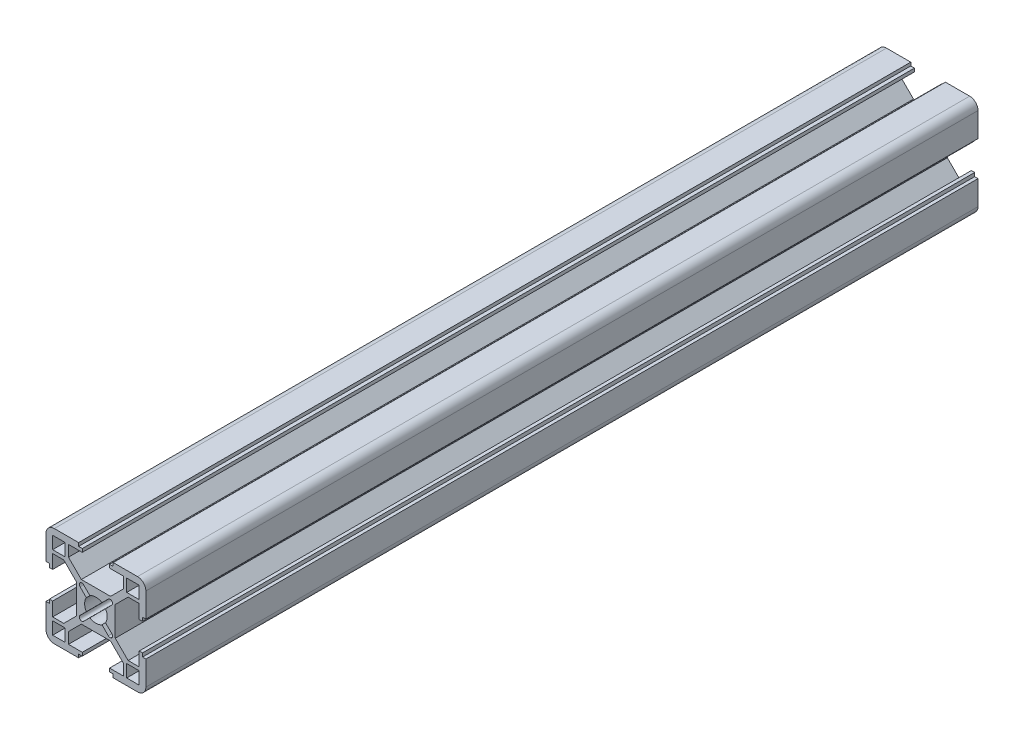
from build123d import *

# Parameters (mm, degrees)
SKETCH_1_W      = 3.75
SKETCH_1_H      = 3.75
EXTRUDE_1_DEPTH = 250


with BuildPart() as part:
    # 草图1 → 凸台-拉伸1 (new body)
    with BuildSketch(Plane.XY):
        with BuildLine():
            Line((-5.2, -15), (-5.2, -14))
            Line((-5.2, -14), (-4.1, -14))
            Line((-4.1, -14), (-4.1, -13))
            Line((-4.1, -13), (-8.25, -13))
            Line((-8.25, -13), (-8.25, -9.664213562))
            Line((-8.25, -9.664213562), (-4.385786438, -5.8))
            Line((-4.385786438, -5.8), (4.385786438, -5.8))
            Line((4.385786438, -5.8), (8.25, -9.664213562))
            Line((8.25, -9.664213562), (8.25, -13))
            Line((8.25, -13), (4.1, -13))
            Line((4.1, -13), (4.1, -14))
            Line((4.1, -14), (5.2, -14))
            Line((5.2, -14), (5.2, -15))
            Line((5.2, -15), (12.5, -15))
            ThreePointArc((12.5, -15), (14.267766953, -14.267766953), (15, -12.5))
            Line((15, -12.5), (15, -5.2))
            Line((15, -5.2), (14, -5.2))
            Line((14, -5.2), (14, -4.1))
            Line((14, -4.1), (13, -4.1))
            Line((13, -4.1), (13, -8.25))
            Line((13, -8.25), (9.664213562, -8.25))
            Line((9.664213562, -8.25), (5.8, -4.385786438))
            Line((5.8, -4.385786438), (5.8, 4.385786438))
            Line((5.8, 4.385786438), (9.664213562, 8.25))
            Line((9.664213562, 8.25), (13, 8.25))
            Line((13, 8.25), (13, 4.1))
            Line((13, 4.1), (14, 4.1))
            Line((14, 4.1), (14, 5.2))
            Line((14, 5.2), (15, 5.2))
            Line((15, 5.2), (15, 12.5))
            ThreePointArc((15, 12.5), (14.267766953, 14.267766953), (12.5, 15))
            Line((12.5, 15), (5.2, 15))
            Line((5.2, 15), (5.2, 14))
            Line((5.2, 14), (4.1, 14))
            Line((4.1, 14), (4.1, 13))
            Line((4.1, 13), (8.25, 13))
            Line((8.25, 13), (8.25, 9.664213562))
            Line((8.25, 9.664213562), (4.385786438, 5.8))
            Line((4.385786438, 5.8), (-4.385786438, 5.8))
            Line((-4.385786438, 5.8), (-8.25, 9.664213562))
            Line((-8.25, 9.664213562), (-8.25, 13))
            Line((-8.25, 13), (-4.1, 13))
            Line((-4.1, 13), (-4.1, 14))
            Line((-4.1, 14), (-5.2, 14))
            Line((-5.2, 14), (-5.2, 15))
            Line((-5.2, 15), (-12.5, 15))
            ThreePointArc((-12.5, 15), (-14.267766953, 14.267766953), (-15, 12.5))
            Line((-15, 12.5), (-15, 5.2))
            Line((-15, 5.2), (-14, 5.2))
            Line((-14, 5.2), (-14, 4.1))
            Line((-14, 4.1), (-13, 4.1))
            Line((-13, 4.1), (-13, 8.25))
            Line((-13, 8.25), (-9.664213562, 8.25))
            Line((-9.664213562, 8.25), (-5.8, 4.385786438))
            Line((-5.8, 4.385786438), (-5.8, -4.385786438))
            Line((-5.8, -4.385786438), (-9.664213562, -8.25))
            Line((-9.664213562, -8.25), (-13, -8.25))
            Line((-13, -8.25), (-13, -4.1))
            Line((-13, -4.1), (-14, -4.1))
            Line((-14, -4.1), (-14, -5.2))
            Line((-14, -5.2), (-15, -5.2))
            Line((-15, -5.2), (-15, -12.5))
            ThreePointArc((-15, -12.5), (-14.267766953, -14.267766953), (-12.5, -15))
            Line((-12.5, -15), (-5.2, -15))
        make_face()
        with Locations((11.125, 11.125)):
            Rectangle(SKETCH_1_W, SKETCH_1_H, mode=Mode.SUBTRACT)
        with Locations((-11.125, 11.125)):
            Rectangle(SKETCH_1_W, SKETCH_1_H, mode=Mode.SUBTRACT)
        with Locations((-11.125, -11.125)):
            Rectangle(SKETCH_1_W, SKETCH_1_H, mode=Mode.SUBTRACT)
        with Locations((11.125, -11.125)):
            Rectangle(SKETCH_1_W, SKETCH_1_H, mode=Mode.SUBTRACT)
        with BuildLine():
            Line((-3.712310601, 4.772970773), (-1.814611278, 2.87527145))
            ThreePointArc((-1.814611278, 2.87527145), (0, 3.4), (1.814611278, 2.87527145))
            Line((1.814611278, 2.87527145), (3.712310601, 4.772970773))
            ThreePointArc((3.712310601, 4.772970773), (4.772970773, 4.772970773), (4.772970773, 3.712310601))
            Line((4.772970773, 3.712310601), (2.87527145, 1.814611278))
            ThreePointArc((2.87527145, 1.814611278), (3.4, 0), (2.87527145, -1.814611278))
            Line((2.87527145, -1.814611278), (4.772970773, -3.712310601))
            ThreePointArc((4.772970773, -3.712310601), (4.772970773, -4.772970773), (3.712310601, -4.772970773))
            Line((3.712310601, -4.772970773), (1.814611278, -2.87527145))
            ThreePointArc((1.814611278, -2.87527145), (0, -3.4), (-1.814611278, -2.87527145))
            Line((-1.814611278, -2.87527145), (-3.712310601, -4.772970773))
            ThreePointArc((-3.712310601, -4.772970773), (-4.772970773, -4.772970773), (-4.772970773, -3.712310601))
            Line((-4.772970773, -3.712310601), (-2.87527145, -1.814611278))
            ThreePointArc((-2.87527145, -1.814611278), (-3.4, 0), (-2.87527145, 1.814611278))
            Line((-2.87527145, 1.814611278), (-4.772970773, 3.712310601))
            ThreePointArc((-4.772970773, 3.712310601), (-4.772970773, 4.772970773), (-3.712310601, 4.772970773))
        make_face(mode=Mode.SUBTRACT)
    extrude(amount=EXTRUDE_1_DEPTH)


solid = part.part
